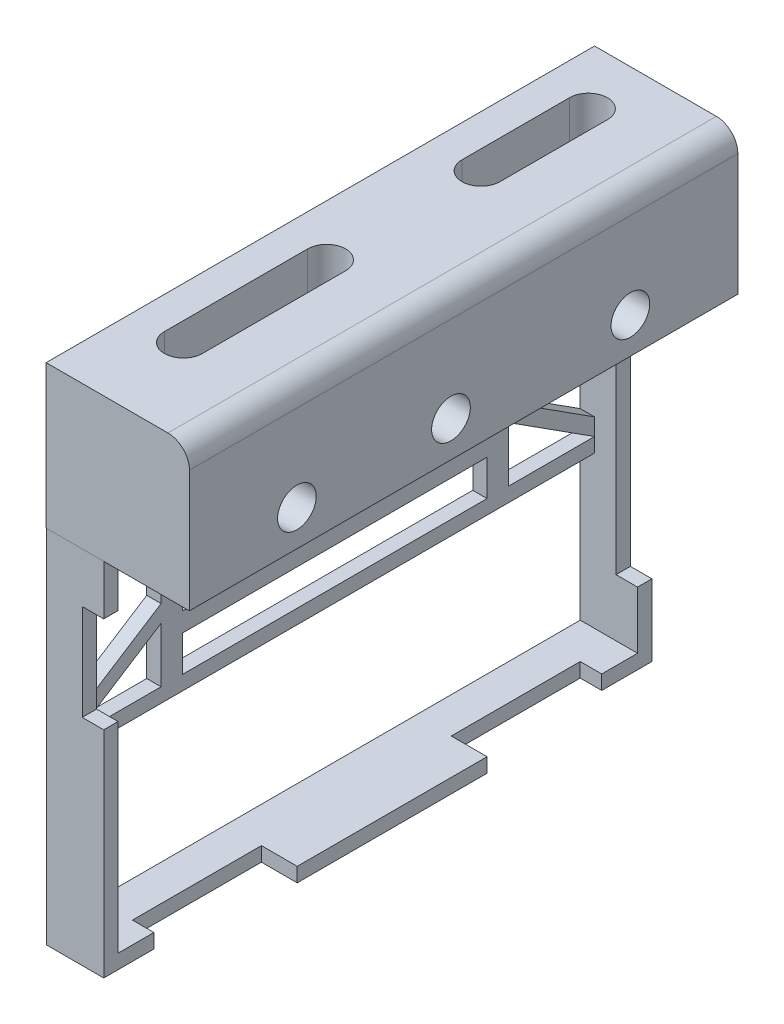
from build123d import *

# Parameters (mm, degrees)
SKETCH_1_W           = 76.5
SKETCH_1_H           = 50.4
SKETCH_1_W_2         = 72.5
SKETCH_1_H_2         = 46.4
EXTRUDE_1_DEPTH      = 3
SKETCH_2_W           = 26.5
SKETCH_2_H           = 2
SKETCH_2_W_2         = 2
SKETCH_2_H_2         = 7
EXTRUDE_2_DEPTH      = 3
EXTRUDE_4_DEPTH      = 2
EXTRUDE_4_DEPTH_BACK = 18
SKETCH_3_W           = 76.541364071
SKETCH_3_H           = 20
SKETCH_3_R           = 2.7
FILLET_1_R           = 3
CUT_EXTRUDE_1_DEPTH  = 18
SKETCH_5_W           = 42.5
SKETCH_5_H           = 5
EXTRUDE_5_DEPTH      = 2
EXTRUDE_6_DEPTH      = 2
SKETCH_7_W           = 26.5
SKETCH_7_H           = 2
EXTRUDE_7_DEPTH      = 2
SKETCH_8_W           = 67.5
SKETCH_8_H           = 2
EXTRUDE_8_DEPTH      = 10


with BuildPart() as part:
    # 草图1 → 凸台-拉伸1 (new body)
    with BuildSketch(Plane(origin=(0, 0, 0), x_dir=(0, 0, -1), z_dir=(1, 0, 0))):
        with Locations((36.25, 23.2)):
            Rectangle(SKETCH_1_W, SKETCH_1_H)
        with Locations((36.25, 23.2)):
            Rectangle(SKETCH_1_W_2, SKETCH_1_H_2, mode=Mode.SUBTRACT)
    extrude(amount=EXTRUDE_1_DEPTH)

    # 草图2 → 凸台-拉伸2 (add)
    with BuildSketch(Plane(origin=(3, 0, 0), x_dir=(0, 0, -1), z_dir=(1, 0, 0))):
        with Locations((36.25, -1)):
            Rectangle(SKETCH_2_W, SKETCH_2_H)
        Polygon((-2, -2), (0, -2), (5, -2), (5, 0), (0, 0), (0, 28), (-2, 28), align=None)
        Polygon((74.5, -2), (72.5, -2), (67.5, -2), (67.5, 0), (72.5, 0), (72.5, 8), (74.5, 8), align=None)
        Polygon((-2, 48.4), (5, 48.4), (5, 46.4), (0, 46.4), (0, 41.4), (-2, 41.4), (-2, 46.4), align=None)
        with Locations((73.5, 44.9)):
            Rectangle(SKETCH_2_W_2, SKETCH_2_H_2)
    extrude(amount=EXTRUDE_2_DEPTH)

    # 草图3 → 凸台-拉伸4 (add, two sides: drawn at the far end of the back side and taken through both)
    with BuildSketch(Plane.ZY.offset(-EXTRUDE_4_DEPTH_BACK)):
        with Locations((-36.229317964, 58.4)):
            Rectangle(SKETCH_3_W, SKETCH_3_H)
        with Locations((-59.5, 53.4)):
            Circle(SKETCH_3_R, mode=Mode.SUBTRACT)
        with Locations((-12.958635929, 53.4)):
            Circle(SKETCH_3_R, mode=Mode.SUBTRACT)
        with Locations((-34.458635929, 53.4)):
            Circle(SKETCH_3_R, mode=Mode.SUBTRACT)
    extrude(amount=EXTRUDE_4_DEPTH + EXTRUDE_4_DEPTH_BACK)

    # 圆角1
    fillet_1_edges = [part.edges().sort_by_distance(p)[0] for p in [
        (18, 68.4, -36.229317964),
    ]]
    fillet(fillet_1_edges, radius=FILLET_1_R)

    # 草图4 → 切除-拉伸1 (cut)
    with BuildSketch(Plane(origin=(0, 68.4, 0), x_dir=(1, 0, 0), z_dir=(0, 1, 0))):
        with BuildLine():
            Line((7.8, 66.5), (7.8, 51.5))
            ThreePointArc((7.8, 51.5), (5.15, 48.85), (2.5, 51.5))
            Line((2.5, 51.5), (2.5, 66.5))
            ThreePointArc((2.5, 66.5), (5.15, 69.15), (7.8, 66.5))
        make_face()
        with BuildLine():
            Line((7.8, 29.958635929), (7.8, 9.958635929))
            ThreePointArc((7.8, 9.958635929), (5.15, 7.308635929), (2.5, 9.958635929))
            Line((2.5, 9.958635929), (2.5, 29.958635929))
            ThreePointArc((2.5, 29.958635929), (5.15, 32.608635929), (7.8, 29.958635929))
        make_face()
    extrude(amount=-CUT_EXTRUDE_1_DEPTH, mode=Mode.SUBTRACT)

    # 草图5 → 凸台-拉伸5 (add)
    with BuildSketch(Plane.ZY):
        Polygon((-35.66479448, 48.4), (-36.83520552, 48.4), (-57.5, 35.174531533), (-57.5, 48.4), (-60.5, 48.4), (-60.5, 33.254531533), (-74.5, 24.294531533), (-74.5, 21.2), (2, 21.2), (2, 24.294531533), (-12, 33.254531533), (-12, 48.4), (-15, 48.4), (-15, 35.174531533), align=None)
        Polygon((-60.5, 23.2), (-72.5, 23.2), (-60.5, 30.88), align=None, mode=Mode.SUBTRACT)
        with Locations((-36.25, 25.7)):
            Rectangle(SKETCH_5_W, SKETCH_5_H, mode=Mode.SUBTRACT)
        Polygon((-12, 30.88), (0, 23.2), (-12, 23.2), align=None, mode=Mode.SUBTRACT)
        Polygon((-57.5, 32.8), (-36.25, 46.4), (-15, 32.8), (-15, 30.88), (-57.5, 30.88), align=None, mode=Mode.SUBTRACT)
    extrude(amount=EXTRUDE_5_DEPTH)

    # 草图6 → 凸台-拉伸6 (add)
    with BuildSketch(Plane.ZY):
        Polygon((0, 46.4), (0, 25.574531533), (2, 24.294531533), (2, 48.4), (-12, 48.4), (-12, 46.4), align=None)
        Polygon((-74.5, 48.4), (-74.5, 24.294531533), (-72.5, 25.574531533), (-72.5, 46.4), (-60.5, 46.4), (-60.5, 48.4), align=None)
        Polygon((2, -2), (2, 21.2), (0, 21.2), (0, 0), (-72.5, 0), (-72.5, 21.2), (-74.5, 21.2), (-74.5, -2), align=None)
        Polygon((-15, 46.4), (-15, 48.4), (-35.66479448, 48.4), (-32.53979448, 46.4), align=None)
        Polygon((-57.5, 46.4), (-39.96020552, 46.4), (-36.83520552, 48.4), (-57.5, 48.4), align=None)
    extrude(amount=EXTRUDE_6_DEPTH)

    # 草图7 → 凸台-拉伸7 (add)
    with BuildSketch(Plane(origin=(6, 0, 0), x_dir=(0, 0, -1), z_dir=(1, 0, 0))):
        with Locations((36.25, -1)):
            Rectangle(SKETCH_7_W, SKETCH_7_H)
    extrude(amount=EXTRUDE_7_DEPTH)

    # 草图8 → 凸台-拉伸8 (add)
    with BuildSketch(Plane(origin=(3, 0, 0), x_dir=(0, 0, -1), z_dir=(1, 0, 0))):
        with Locations((38.75, 47.4)):
            Rectangle(SKETCH_8_W, SKETCH_8_H)
    extrude(amount=EXTRUDE_8_DEPTH)


solid = part.part
